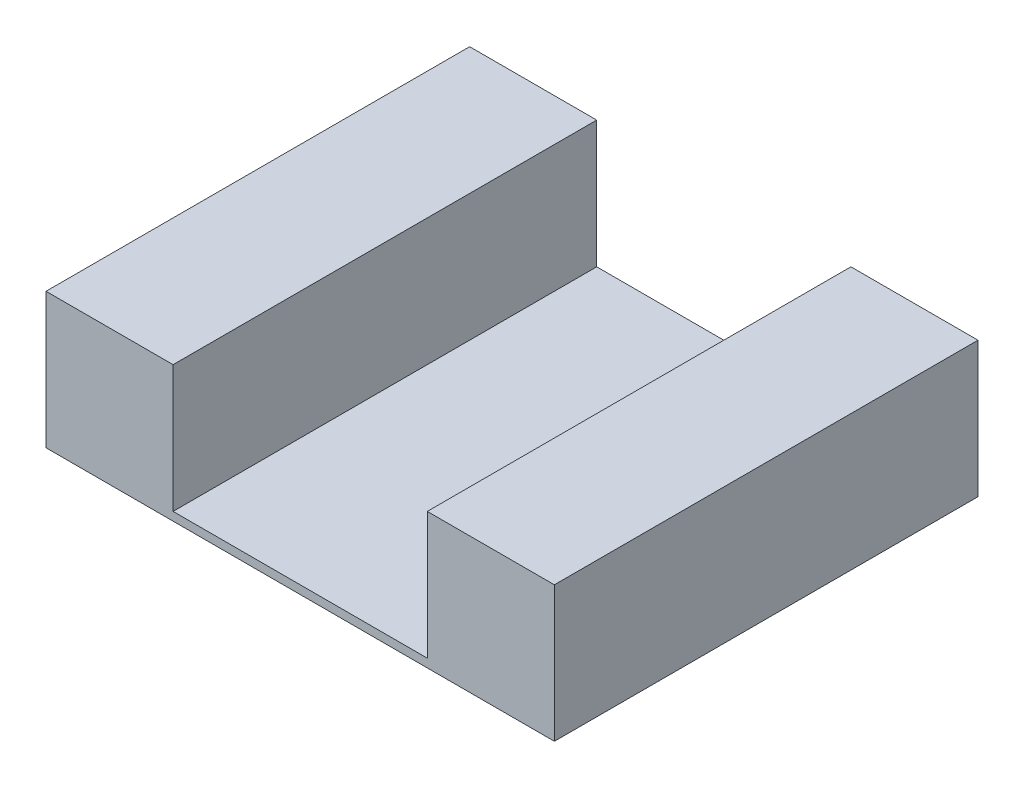
from build123d import *

# Parameters (mm, degrees)
EXTRUDE_1_DEPTH = 500


with BuildPart() as part:
    # 草图1 → 凸台-拉伸1 (new body)
    with BuildSketch(Plane.XY):
        Polygon((0, 0), (0, 160), (150, 160), (150, 10), (450, 10), (450, 160), (600, 160), (600, 0), align=None)
    extrude(amount=EXTRUDE_1_DEPTH)


solid = part.part
